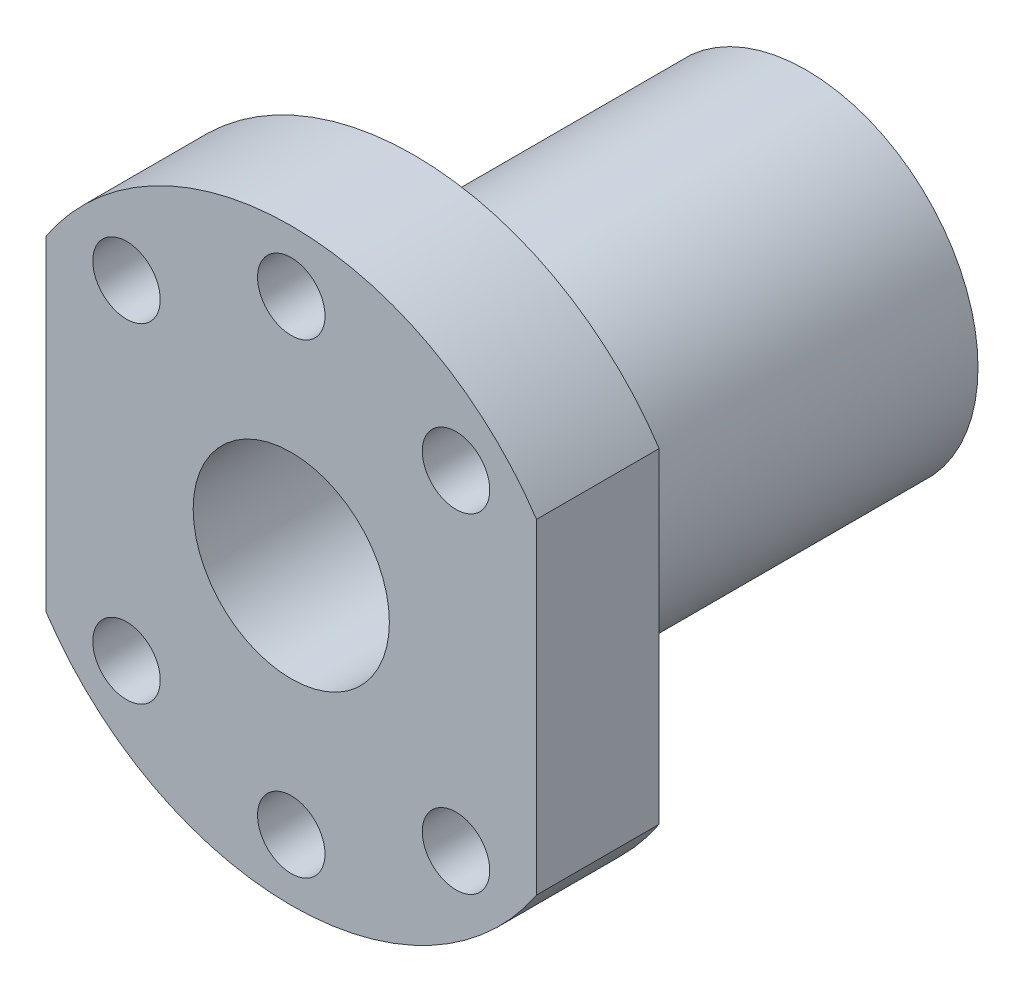
from build123d import *

# Parameters (mm, degrees)
ESQUISSE1_R        = 14
ESQUISSE1_R_2      = 8
BOSS_EXTRU_1_DEPTH = 32
ESQUISSE2_R        = 8
ESQUISSE2_R_2      = 2.75
BOSS_EXTRU_2_DEPTH = 10


with BuildPart() as part:
    # Esquisse1 → Boss.-Extru.1 (new body)
    with BuildSketch(Plane.XY):
        Circle(ESQUISSE1_R)
        Circle(ESQUISSE1_R_2, mode=Mode.SUBTRACT)
    extrude(amount=BOSS_EXTRU_1_DEPTH)

    # Esquisse2 → Boss.-Extru.2 (add)
    with BuildSketch(Plane.XY.offset(32)):
        with BuildLine():
            Line((20, 13.266499161), (20, -13.266499161))
            ThreePointArc((20, -13.266499161), (0, -24), (-20, -13.266499161))
            Line((-20, -13.266499161), (-20, 13.266499161))
            ThreePointArc((-20, 13.266499161), (0, 24), (20, 13.266499161))
        make_face()
        Circle(ESQUISSE2_R, mode=Mode.SUBTRACT)
        with Locations((0, 19)):
            Circle(ESQUISSE2_R_2, mode=Mode.SUBTRACT)
        with Locations((-13.435028843, 13.435028843)):
            Circle(ESQUISSE2_R_2, mode=Mode.SUBTRACT)
        with Locations((13.435028843, 13.435028843)):
            Circle(ESQUISSE2_R_2, mode=Mode.SUBTRACT)
        with Locations((0, -19)):
            Circle(ESQUISSE2_R_2, mode=Mode.SUBTRACT)
        with Locations((13.435028843, -13.435028843)):
            Circle(ESQUISSE2_R_2, mode=Mode.SUBTRACT)
        with Locations((-13.435028843, -13.435028843)):
            Circle(ESQUISSE2_R_2, mode=Mode.SUBTRACT)
    extrude(amount=BOSS_EXTRU_2_DEPTH)


solid = part.part
